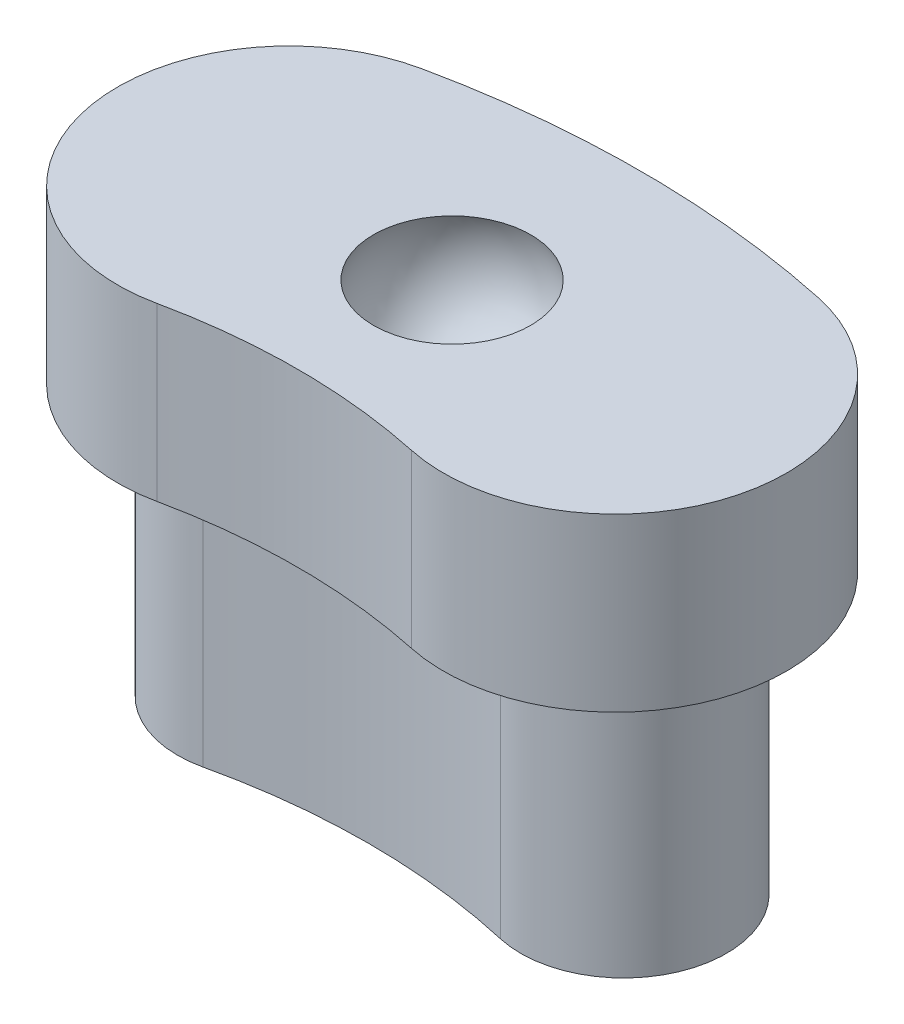
from build123d import *

# Parameters (mm, degrees)
BOSS_EXTRUDE2_DEPTH = 5
BOSS_EXTRUDE3_DEPTH = 8


with BuildPart() as part:
    # Sketch5 → Boss-Extrude2 (new body)
    with BuildSketch(Plane(origin=(0, 0, 0), x_dir=(1, 0, 0), z_dir=(0, 1, 0))):
        with BuildLine():
            ThreePointArc((5.79109589, 4.890410959), (0, 5.5), (-5.79109589, 4.890410959))
            ThreePointArc((-5.79109589, 4.890410959), (-9.640410959, -1.04109589), (-3.70890411, -4.890410959))
            ThreePointArc((-3.70890411, -4.890410959), (0, -4.5), (3.70890411, -4.890410959))
            ThreePointArc((3.70890411, -4.890410959), (9.640410959, -1.04109589), (5.79109589, 4.890410959))
        make_face()
    extrude(amount=BOSS_EXTRUDE2_DEPTH)

    # Sketch9 → Boss-Extrude3 (add)
    with BuildSketch(Plane.XZ):
        with BuildLine():
            ThreePointArc((-5.666666667, -2.924988129), (0, -3.562589032), (5.666666667, -2.924988129))
            ThreePointArc((5.666666667, -2.924988129), (7.924988129, 0.666666667), (4.333333333, 2.924988129))
            ThreePointArc((4.333333333, 2.924988129), (0, 2.437410968), (-4.333333333, 2.924988129))
            ThreePointArc((-4.333333333, 2.924988129), (-7.924988129, 0.666666667), (-5.666666667, -2.924988129))
        make_face()
    extrude(amount=BOSS_EXTRUDE3_DEPTH)

    # Sketch11 → Cut-Revolve1 (revolve, cut)
    with BuildSketch(Plane(origin=(0, 4, 0), x_dir=(1, 0, 0), z_dir=(0, 1, 0))):
        with BuildLine():
            Line((0, 2.5), (0, -2.5))
            ThreePointArc((0, -2.5), (-2.5, 0), (0, 2.5))
        make_face()
    revolve(axis=Axis((0, 4, -2.5), (0, 0, 1)), mode=Mode.SUBTRACT)


solid = part.part
